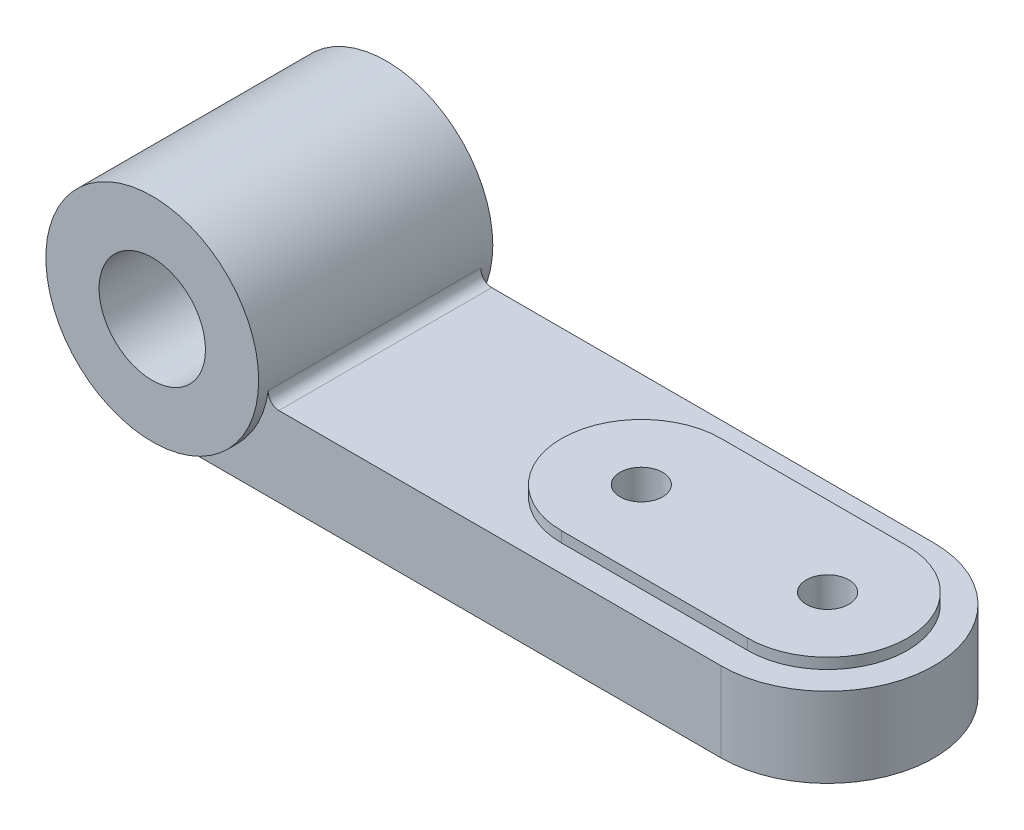
from build123d import *

# Parameters (mm, degrees)
SKETCH1_R                = 4
BOSS_EXTRUDE1_DEPTH      = 15
BOSS_EXTRUDE2_DEPTH      = 22
BOSS_EXTRUDE2_DEPTH_BACK = 22
SKETCH3_R                = 20
SKETCH4_R                = 10
CUT_EXTRUDE1_DEPTH       = 94.766915104
SKETCH5_R                = 4
BOSS_EXTRUDE3_DEPTH      = 2
FILLET2_R                = 2


with BuildPart() as part:
    # Sketch1 → Boss-Extrude1 (new body)
    with BuildSketch(Plane(origin=(0, 0, 0), x_dir=(1, 0, 0), z_dir=(0, 1, 0))):
        with BuildLine():
            Line((-52.5, 20), (52.5, 20))
            ThreePointArc((52.5, 20), (72.5, 0), (52.5, -20))
            Line((52.5, -20), (-52.5, -20))
            Line((-52.5, -20), (-52.5, 20))
        make_face()
        with Locations(Location((17.5, 0, 0), (0, 0, 270))):
            Circle(SKETCH1_R, mode=Mode.SUBTRACT)
        with Locations(Location((52.5, 0, 0), (0, 0, 270))):
            Circle(SKETCH1_R, mode=Mode.SUBTRACT)
    extrude(amount=BOSS_EXTRUDE1_DEPTH)

    # Sketch3 → Boss-Extrude2 (add, two sides: drawn at the far end of the back side and taken through both)
    with BuildSketch(Plane.XY.offset(-BOSS_EXTRUDE2_DEPTH_BACK)):
        with Locations((-52.411592251, 19.999804601)):
            Circle(SKETCH3_R)
    extrude(amount=BOSS_EXTRUDE2_DEPTH + BOSS_EXTRUDE2_DEPTH_BACK)

    # Sketch4 → Cut-Extrude1 (cut, through all)
    with BuildSketch(Plane.XY.offset(22)):
        with Locations((-52.411592251, 19.999804601)):
            Circle(SKETCH4_R)
    extrude(amount=-CUT_EXTRUDE1_DEPTH, mode=Mode.SUBTRACT)

    # Sketch5 → Boss-Extrude3 (add)
    with BuildSketch(Plane(origin=(0, 15, 0), x_dir=(1, 0, 0), z_dir=(0, 1, 0))):
        with BuildLine():
            Line((17.5, 15), (52.5, 15))
            ThreePointArc((52.5, 15), (67.5, 0), (52.5, -15))
            Line((52.5, -15), (17.5, -15))
            ThreePointArc((17.5, -15), (2.5, 0), (17.5, 15))
        make_face()
        with Locations(Location((17.5, 0, 0), (0, 0, 270))):
            Circle(SKETCH5_R, mode=Mode.SUBTRACT)
        with Locations(Location((52.5, 0, 0), (0, 0, 270))):
            Circle(SKETCH5_R, mode=Mode.SUBTRACT)
    extrude(amount=BOSS_EXTRUDE3_DEPTH)

    # Fillet2
    fillet2_edges = [part.edges().sort_by_distance(p)[0] for p in [
        (-33.046625069, 15, 0),
    ]]
    fillet(fillet2_edges, radius=FILLET2_R)


solid = part.part
